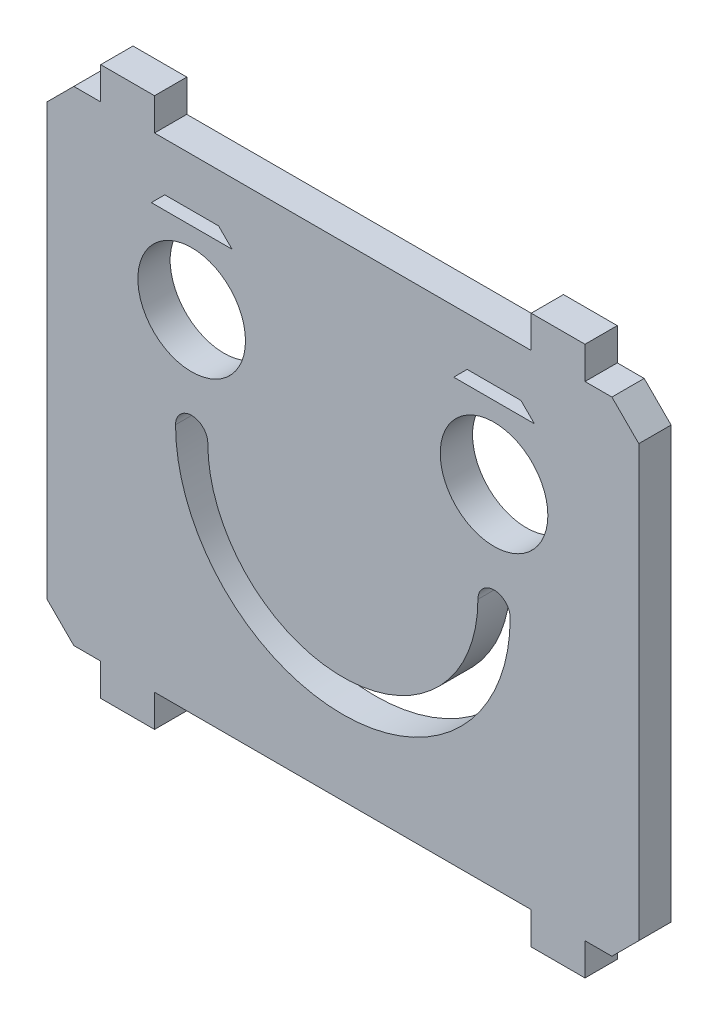
from build123d import *

# Parameters (mm, degrees)
SKETCH1_R           = 10
BOSS_EXTRUDE2_DEPTH = 6


with BuildPart() as part:
    # Sketch1 → Boss-Extrude2 (new body)
    with BuildSketch(Plane.XY):
        Polygon((-35, 51), (-45, 51), (-45, 45), (-50, 45), (-55, 40), (-55, -40), (-50, -45), (-45, -45), (-45, -51), (-35, -51), (-35, -45), (35, -45), (35, -51), (45, -51), (45, -45), (50, -45), (55, -40), (55, 40), (50, 45), (45, 45), (45, 51), (35, 51), (35, 45), (-35, 45), align=None)
        Polygon((33.096829988, 36), (35.596829988, 33.5), (20.596829988, 33.5), (23.096829988, 36), align=None, mode=Mode.SUBTRACT)
        with BuildLine():
            ThreePointArc((31.096829988, 0), (0, -31.096829988), (-31.096829988, 0))
            ThreePointArc((-31.096829988, 0), (-28.096829988, 3), (-25.096829988, 0))
            ThreePointArc((-25.096829988, 0), (0, -25.096829988), (25.096829988, 0))
            ThreePointArc((25.096829988, 0), (28.096829988, 3), (31.096829988, 0))
        make_face(mode=Mode.SUBTRACT)
        with Locations((-28.096829988, 20)):
            Circle(SKETCH1_R, mode=Mode.SUBTRACT)
        Polygon((-35.596829988, 33.5), (-33.096829988, 36), (-23.096829988, 36), (-20.596829988, 33.5), align=None, mode=Mode.SUBTRACT)
        with Locations((28.096829988, 20)):
            Circle(SKETCH1_R, mode=Mode.SUBTRACT)
    extrude(amount=BOSS_EXTRUDE2_DEPTH)


solid = part.part
